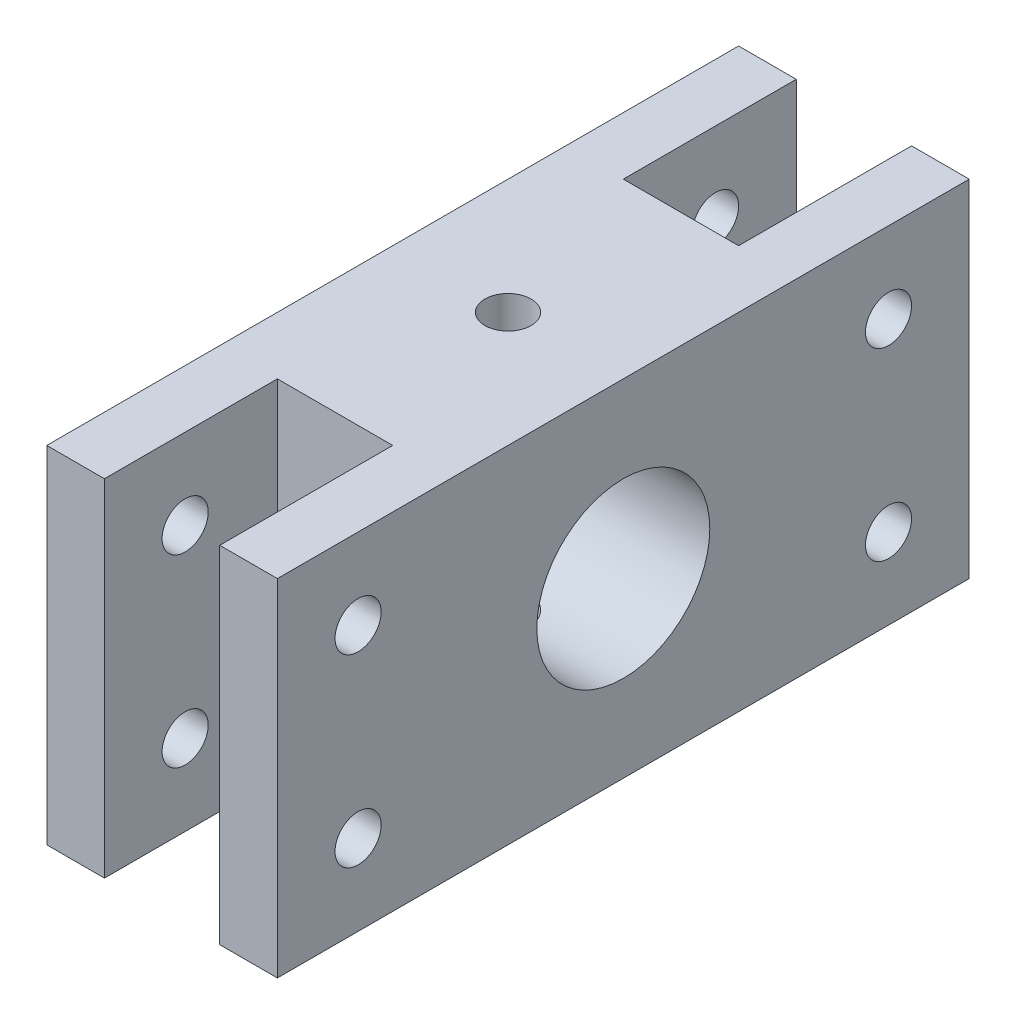
from build123d import *

# Parameters (mm, degrees)
SKETCH_1_W          = 60
SKETCH_1_H          = 30
SKETCH_1_R          = 2
EXTRUDE_1_DEPTH     = 20
SKETCH_2_W          = 10
SKETCH_2_H          = 15
CUT_EXTRUDE_1_DEPTH = 47.904157598
SKETCH_3_R          = 7.5
CUT_EXTRUDE_2_DEPTH = 20
SKETCH_4_R          = 2
CUT_EXTRUDE_3_DEPTH = 47.904157598


with BuildPart() as part:
    # 스케치1 → 보스-돌출1 (new body)
    with BuildSketch(Plane(origin=(0, 0, 0), x_dir=(0, 0, -1), z_dir=(1, 0, 0))):
        Rectangle(SKETCH_1_W, SKETCH_1_H)
        with Locations((-23, 8)):
            Circle(SKETCH_1_R, mode=Mode.SUBTRACT)
        with Locations(Location((-23, -8, 0), (0, 0, 180))):
            Circle(SKETCH_1_R, mode=Mode.SUBTRACT)
        with Locations((23, -8)):
            Circle(SKETCH_1_R, mode=Mode.SUBTRACT)
        with Locations(Location((23, 8, 0), (0, 0, 180))):
            Circle(SKETCH_1_R, mode=Mode.SUBTRACT)
    extrude(amount=EXTRUDE_1_DEPTH)

    # 스케치2 → 컷-돌출1 (cut, through all)
    with BuildSketch(Plane(origin=(0, 15, 0), x_dir=(1, 0, 0), z_dir=(0, 1, 0))):
        with Locations((10, 22.5)):
            Rectangle(SKETCH_2_W, SKETCH_2_H)
        with Locations((10, -22.5)):
            Rectangle(SKETCH_2_W, SKETCH_2_H)
    extrude(amount=-CUT_EXTRUDE_1_DEPTH, mode=Mode.SUBTRACT)

    # 스케치3 → 컷-돌출2 (cut)
    with BuildSketch(Plane.ZY):
        Circle(SKETCH_3_R)
    extrude(amount=-CUT_EXTRUDE_2_DEPTH, mode=Mode.SUBTRACT)

    # 스케치4 → 컷-돌출3 (cut, through all)
    with BuildSketch(Plane(origin=(0, 15, 0), x_dir=(1, 0, 0), z_dir=(0, 1, 0))):
        with Locations(Location((10, 0, 0), (0, 0, 270))):
            Circle(SKETCH_4_R)
    extrude(amount=-CUT_EXTRUDE_3_DEPTH, mode=Mode.SUBTRACT)


solid = part.part
